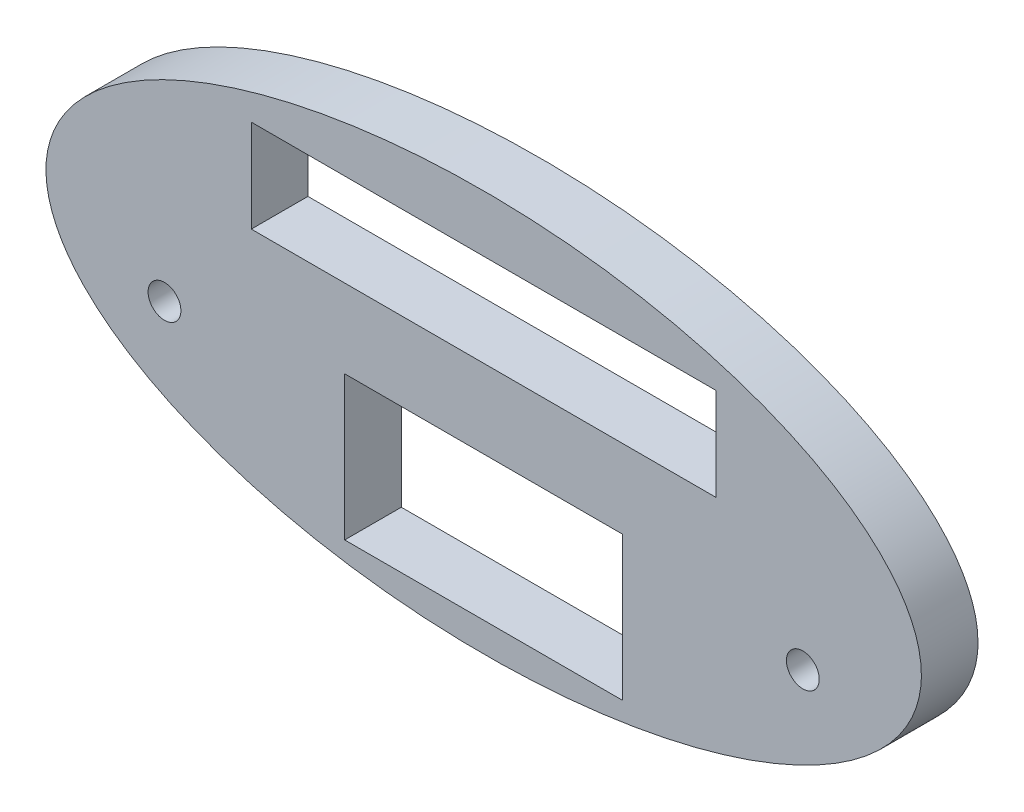
from build123d import *

# Parameters (mm, degrees)
SKETCH1_RX          = 240
SKETCH1_RY          = 110
BOSS_EXTRUDE1_DEPTH = 31.055
SKETCH10_W          = 254.8
SKETCH10_H          = 50.8
CUT_EXTRUDE5_DEPTH  = 266.827788286
SKETCH13_W          = 152.4
SKETCH13_H          = 78.9
CUT_EXTRUDE7_DEPTH  = 266.827788286
SKETCH12_R          = 9
CUT_EXTRUDE8_DEPTH  = 266.827788286


with BuildPart() as part:
    # Sketch1 → Boss-Extrude1 (new body)
    with BuildSketch(Plane.XY):
        with Locations((0, 0)):
            Ellipse(SKETCH1_RX, SKETCH1_RY)
    extrude(amount=-BOSS_EXTRUDE1_DEPTH)

    # Sketch10 → Cut-Extrude5 (cut, through all)
    with BuildSketch(Plane.XY):
        with Locations((0, 53.5)):
            Rectangle(SKETCH10_W, SKETCH10_H)
    extrude(amount=-CUT_EXTRUDE5_DEPTH, mode=Mode.SUBTRACT)

    # Sketch13 → Cut-Extrude7 (cut, through all)
    with BuildSketch(Plane.XY):
        with Locations((0, -54.45)):
            Rectangle(SKETCH13_W, SKETCH13_H)
    extrude(amount=-CUT_EXTRUDE7_DEPTH, mode=Mode.SUBTRACT)

    # Sketch12 → Cut-Extrude8 (cut, through all)
    with BuildSketch(Plane.XY):
        with Locations((175, -30)):
            Circle(SKETCH12_R)
        with Locations(Location((-175, -30, 0), (0, 0, 180))):
            Circle(SKETCH12_R)
    extrude(amount=-CUT_EXTRUDE8_DEPTH, mode=Mode.SUBTRACT)


solid = part.part
